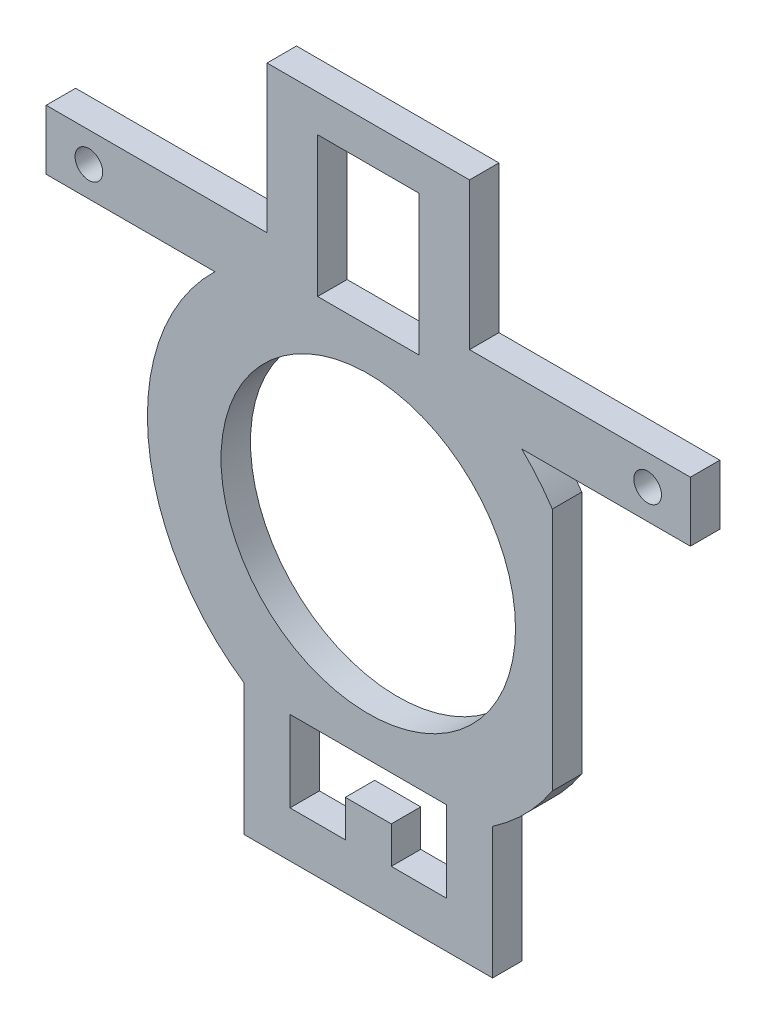
from build123d import *

# Parameters (mm, degrees)
SKETCH1_W           = 5.5
SKETCH1_H           = 7.612305333
SKETCH1_R           = 0.75
SKETCH1_R_2         = 8
BOSS_EXTRUDE1_DEPTH = 1.6


with BuildPart() as part:
    # Sketch1 → Boss-Extrude1 (new body)
    with BuildSketch(Plane.XY):
        with BuildLine():
            Line((5.5, 19.87), (-5.5, 19.87))
            Line((-5.5, 19.87), (-5.5, 11.882694667))
            Line((-5.5, 11.882694667), (-17.5, 11.882694667))
            Line((-17.5, 11.882694667), (-17.5, 8.632694667))
            Line((-17.5, 8.632694667), (-8.335261411, 8.632694667))
            ThreePointArc((-8.335261411, 8.632694667), (-11.956670593, -1.018836756), (-6.7545, -9.918504411))
            Line((-6.7545, -9.918504411), (-6.7545, -17.054889955))
            Line((-6.7545, -17.054889955), (6.7545, -17.054889955))
            Line((6.7545, -17.054889955), (6.7545, -9.918504411))
            ThreePointArc((6.7545, -9.918504411), (8.536775878, -8.433472453), (10, -6.633249581))
            Line((10, -6.633249581), (10, 6.633249581))
            ThreePointArc((10, 6.633249581), (9.221979067, 7.678222586), (8.335261411, 8.632694667))
            Line((8.335261411, 8.632694667), (17.5, 8.632694667))
            Line((17.5, 8.632694667), (17.5, 11.882694667))
            Line((17.5, 11.882694667), (5.5, 11.882694667))
            Line((5.5, 11.882694667), (5.5, 19.87))
        make_face()
        with Locations((0, 14.063847334)):
            Rectangle(SKETCH1_W, SKETCH1_H, mode=Mode.SUBTRACT)
        Polygon((-4.2545, -10.154889955), (4.2545, -10.154889955), (4.2545, -14.554889955), (1.25, -14.554889955), (1.25, -12.554889955), (-1.25, -12.554889955), (-1.25, -14.554889955), (-4.2545, -14.554889955), align=None, mode=Mode.SUBTRACT)
        with Locations((-15.18, 10.257694667)):
            Circle(SKETCH1_R, mode=Mode.SUBTRACT)
        Circle(SKETCH1_R_2, mode=Mode.SUBTRACT)
        with Locations((15.18, 10.257694667)):
            Circle(SKETCH1_R, mode=Mode.SUBTRACT)
    extrude(amount=BOSS_EXTRUDE1_DEPTH)


solid = part.part
